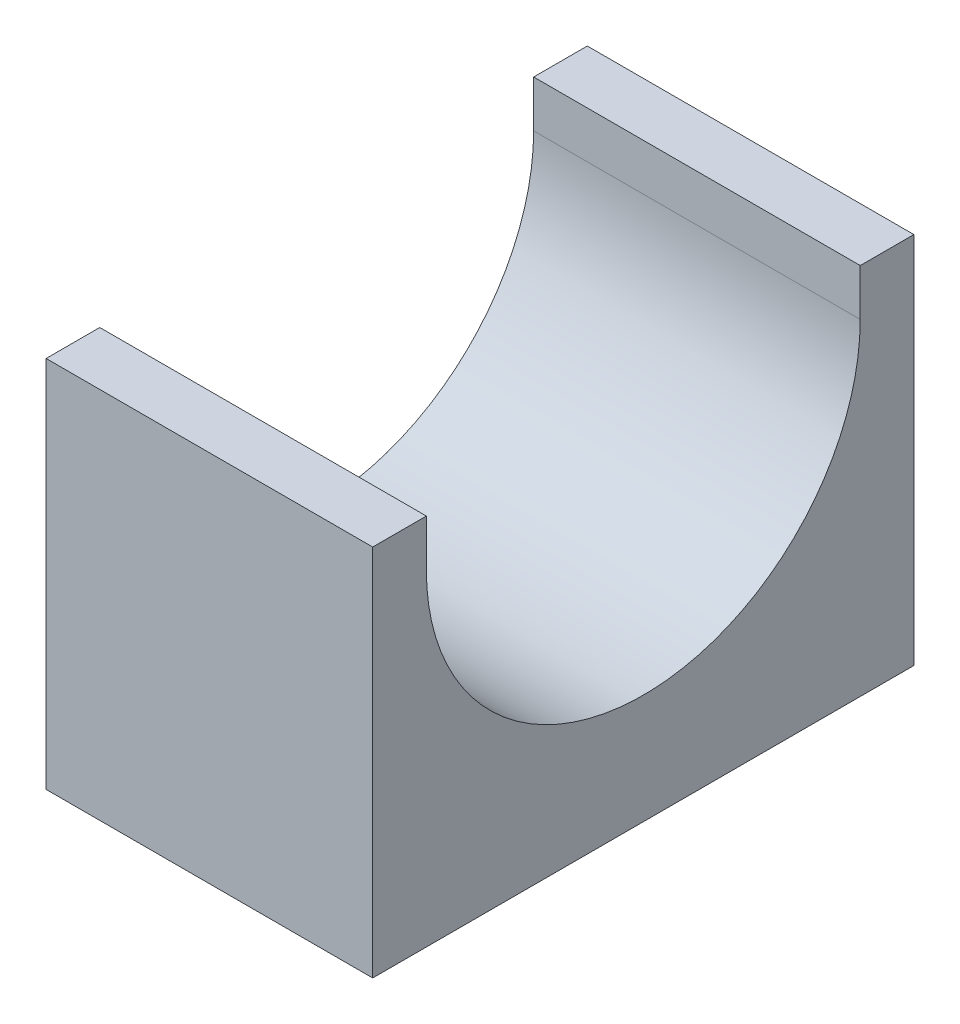
from build123d import *

# Parameters (mm, degrees)
SKETCH1_W           = 35
SKETCH1_H           = 58
BOSS_EXTRUDE1_DEPTH = 40
CUT_EXTRUDE1_DEPTH  = 61.547502013


with BuildPart() as part:
    # Sketch1 → Boss-Extrude1 (new body)
    with BuildSketch(Plane(origin=(0, 0, 0), x_dir=(1, 0, 0), z_dir=(0, 1, 0))):
        Rectangle(SKETCH1_W, SKETCH1_H)
    extrude(amount=BOSS_EXTRUDE1_DEPTH)

    # Sketch2 → Cut-Extrude1 (cut, through all)
    with BuildSketch(Plane(origin=(17.5, 0, 0), x_dir=(0, 0, -1), z_dir=(1, 0, 0))):
        with BuildLine():
            Line((-23.25, 35), (-23.25, 58.25))
            Line((-23.25, 58.25), (23.25, 58.25))
            Line((23.25, 58.25), (23.25, 35))
            ThreePointArc((23.25, 35), (0, 11.75), (-23.25, 35))
        make_face()
    extrude(amount=-CUT_EXTRUDE1_DEPTH, mode=Mode.SUBTRACT)


solid = part.part
